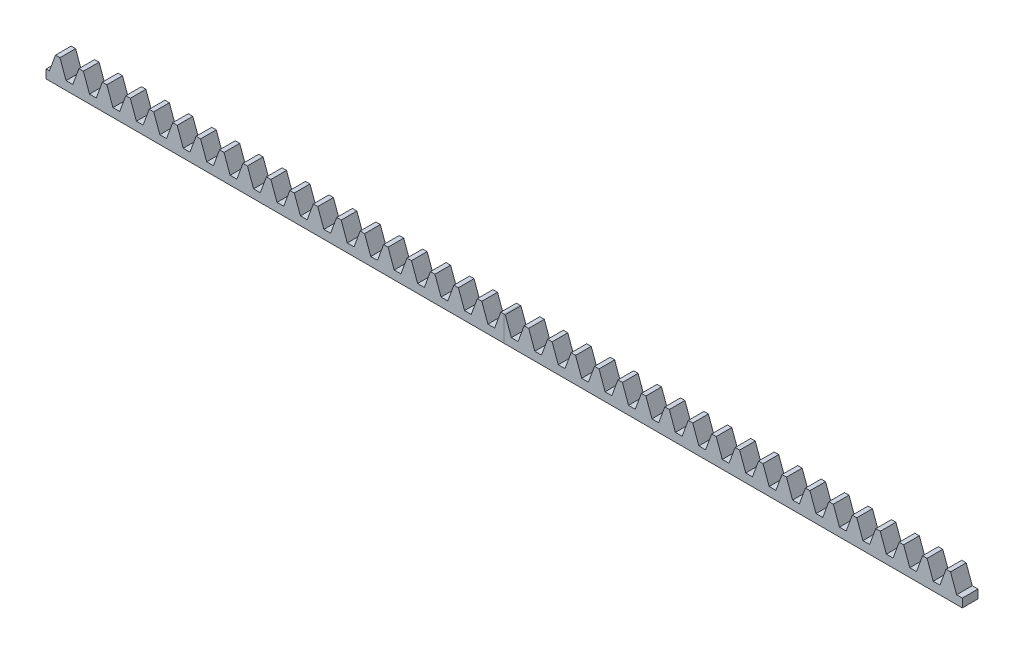
from build123d import *

# Parameters (mm, degrees)
BLANKSKE_W        = 519.99896
BLANKSKE_H        = 14.393333333
BLANK_DEPTH       = 8.89
TOOTHCUTSIM_DEPTH = 521.274080217
TEETHCUTS_COUNT   = 40
TEETHCUTS_PITCH   = 13.299408885


with BuildPart() as part:
    # BlankSke → Blank (new body)
    with BuildSketch(Plane.XY):
        with Locations((259.99948, 7.196666667)):
            Rectangle(BLANKSKE_W, BLANKSKE_H)
    extrude(amount=-BLANK_DEPTH)

    # TooCutSkeSim → ToothCutSim (cut, through all)
    with BuildSketch(Plane.XY):
        Polygon((1.909383065, 4.868333333), (-1.909383065, 4.868333333), (-5.38544439, 14.418733333), (5.38544439, 14.418733333), align=None)
    toothcutsim = extrude(amount=-TOOTHCUTSIM_DEPTH, mode=Mode.SUBTRACT)

    # TeethCuts: ToothCutSim ×40
    with Locations(*[(i * TEETHCUTS_PITCH, 0, 0) for i in range(1, TEETHCUTS_COUNT)]):
        add(toothcutsim, mode=Mode.SUBTRACT)


with BuildPart() as body_2:
    # Split1: the piece on the far side of the plane
    add(part.part)
    split(bisect_by=Plane(origin=(259.999999938, 0, 0), x_dir=(0, 0, -1), z_dir=(-1, 0, 0)), keep=Keep.BOTTOM)


with BuildPart() as part_1:
    add(part.part)

    # Split1
    split(bisect_by=Plane(origin=(259.999999938, 0, 0), x_dir=(0, 0, -1), z_dir=(-1, 0, 0)), keep=Keep.TOP)


solid = Compound([body_2.part, part_1.part])
